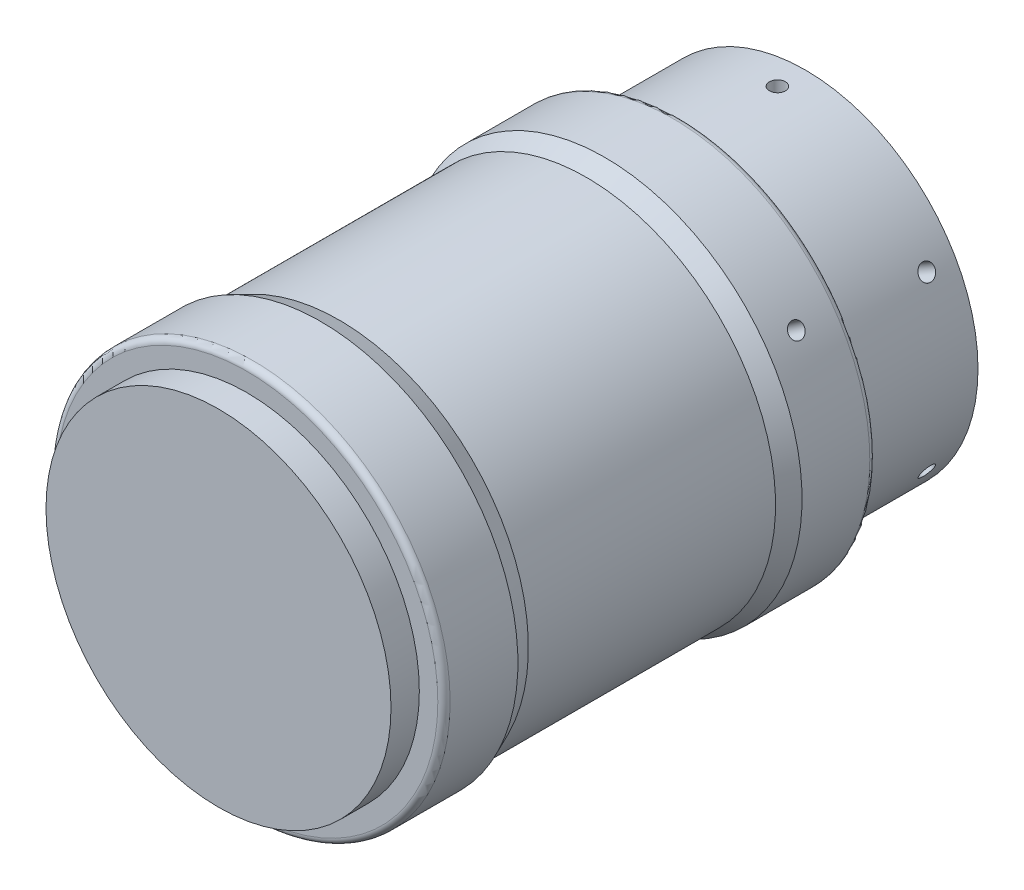
from build123d import *

# Parameters (mm, degrees)
SKETCH1_R                           = 28
BOSS_EXTRUDE1_DEPTH                 = 20.56
SKETCH2_R                           = 30.7
BOSS_EXTRUDE2_DEPTH                 = 70.12
SKETCH3_R                           = 28
BOSS_EXTRUDE3_DEPTH                 = 4.6
F_5_40_TAPPED_HOLE1_D               = 2.5781
F_5_40_TAPPED_HOLE1_ON_FACE_2_D     = 2.5781
F_5_40_TAPPED_HOLE1_ON_FACE_3_D     = 2.5781
M3X0_5_TAPPED_HOLE1_D               = 2.5
M3X0_5_TAPPED_HOLE1_DEPTH           = 7.5
M3X0_5_TAPPED_HOLE1_TIP             = 0.751075774
M3X0_5_TAPPED_HOLE1_ON_FACE_2_D     = 2.5
M3X0_5_TAPPED_HOLE1_ON_FACE_2_DEPTH = 7.5
M3X0_5_TAPPED_HOLE1_ON_FACE_2_TIP   = 0.751075774
FILLET1_R                           = 1


with BuildPart() as part:
    # Sketch1 → Boss-Extrude1 (new body)
    with BuildSketch(Plane.XY):
        Circle(SKETCH1_R)
    extrude(amount=BOSS_EXTRUDE1_DEPTH)

    # Sketch2 → Boss-Extrude2 (add)
    with BuildSketch(Plane.XY.offset(20.56)):
        Circle(SKETCH2_R)
    extrude(amount=BOSS_EXTRUDE2_DEPTH)

    # Sketch3 → Boss-Extrude3 (add)
    with BuildSketch(Plane.XY.offset(90.68)):
        Circle(SKETCH3_R)
    extrude(amount=BOSS_EXTRUDE3_DEPTH)

    # Sketch4 → Revolve1 (revolve)
    with BuildSketch(Plane(origin=(0, 0, 0), x_dir=(0, 0, -1), z_dir=(1, 0, 0)), mode=Mode.PRIVATE) as revolve1_sk:
        Polygon((-20.56, 30.7), (-20.56, 32), (-32.56, 32), (-35.56, 30.7), align=None)
        Polygon((-75.68, 30.7), (-90.68, 30.7), (-90.68, 32), (-78.68, 32), align=None)
    revolve(revolve1_sk.sketch.rotate(Axis((0, 0, 0), (0, 0, 1)), 90), axis=Axis((0, 0, 0), (0, 0, 1)))

    # #5-40 Tapped Hole1 (through all)
    with Locations(Plane(origin=(24.248711306, 14, 4.56), x_dir=(-0.5, 0.866025403784, 0), z_dir=(0.866025403784, 0.5, 0))):
        with Locations((0, 0)):
            Hole(F_5_40_TAPPED_HOLE1_D / 2)

    # #5-40 Tapped Hole1 on face 2 (through all)
    with Locations(Plane(origin=(-0.009573975, 27.999998363, 4.56), x_dir=(0.999999941518, 0.00034199998, 0), z_dir=(-0.00034199998, 0.999999941518, 0))):
        with Locations((0, 0)):
            Hole(F_5_40_TAPPED_HOLE1_ON_FACE_2_D / 2)

    # #5-40 Tapped Hole1 on face 3 (through all)
    with Locations(Plane(origin=(-24.248711306, 14, 4.56), x_dir=(-0.500000174844, -0.866025302838, 0), z_dir=(-0.866025302838, 0.500000174844, 0))):
        with Locations((0, 0)):
            Hole(F_5_40_TAPPED_HOLE1_ON_FACE_3_D / 2)

    # M3x0.5 Tapped Hole1
    with Locations(Plane(origin=(26.212865417, 18.354445963, 27.696295827), x_dir=(-0.573576436351, 0.819152044289, 0), z_dir=(0.819152044289, 0.573576436351, 0))):
        with Locations((0, 0)):
            Hole(M3X0_5_TAPPED_HOLE1_D / 2, depth=M3X0_5_TAPPED_HOLE1_DEPTH)
            with Locations((0, 0, -(M3X0_5_TAPPED_HOLE1_DEPTH + M3X0_5_TAPPED_HOLE1_TIP / 2))):  # 118° drill point
                Cone(0, M3X0_5_TAPPED_HOLE1_D / 2, M3X0_5_TAPPED_HOLE1_TIP, mode=Mode.SUBTRACT)

    # M3x0.5 Tapped Hole1 on face 2
    with Locations(Plane(origin=(-26.212865417, 18.354445963, 82), x_dir=(-0.573576164364, -0.819152234736, 0), z_dir=(-0.819152234736, 0.573576164364, 0))):
        with Locations((0, 0)):
            Hole(M3X0_5_TAPPED_HOLE1_ON_FACE_2_D / 2, depth=M3X0_5_TAPPED_HOLE1_ON_FACE_2_DEPTH)
            with Locations((0, 0, -(M3X0_5_TAPPED_HOLE1_ON_FACE_2_DEPTH + M3X0_5_TAPPED_HOLE1_ON_FACE_2_TIP / 2))):  # 118° drill point
                Cone(0, M3X0_5_TAPPED_HOLE1_ON_FACE_2_D / 2, M3X0_5_TAPPED_HOLE1_ON_FACE_2_TIP, mode=Mode.SUBTRACT)

    # Fillet1
    fillet1_edges = [part.edges().sort_by_distance(p)[0] for p in [
        (32, 0, 20.56),
        (32, 0, 90.68),
    ]]
    fillet(fillet1_edges, radius=FILLET1_R)


solid = part.part
